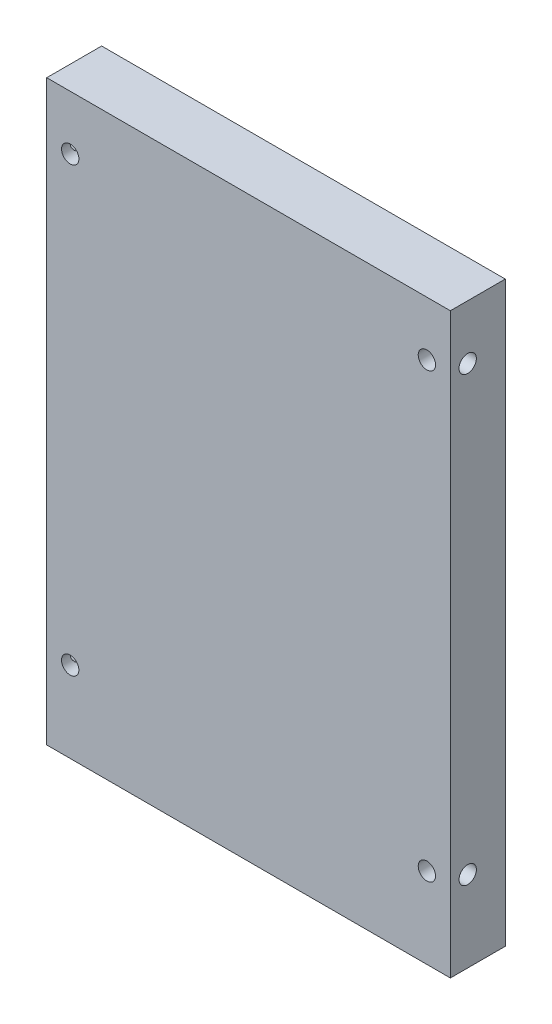
from build123d import *

# Parameters (mm, degrees)
SKETCH_1_W          = 69.85
SKETCH_1_H          = 100
EXTRUDE_1_DEPTH     = 9.5
SKETCH_2_R          = 1.5
CUT_EXTRUDE_1_DEPTH = 3
SKETCH_4_R          = 1.5
CUT_EXTRUDE_3_DEPTH = 3


with BuildPart() as part:
    # 스케치1 → 보스-돌출1 (new body)
    with BuildSketch(Plane.XY):
        with Locations((34.925, 50)):
            Rectangle(SKETCH_1_W, SKETCH_1_H)
    extrude(amount=EXTRUDE_1_DEPTH)

    # 스케치2 → 컷-돌출1 (cut)
    with BuildSketch(Plane(origin=(69.85, 0, 0), x_dir=(0, 0, -1), z_dir=(1, 0, 0))):
        with Locations((-6.5, 90.6)):
            Circle(SKETCH_2_R)
        with Locations(Location((-6.5, 14, 0), (0, 0, 180))):
            Circle(SKETCH_2_R)
    cut_extrude_1 = extrude(amount=-CUT_EXTRUDE_1_DEPTH, mode=Mode.SUBTRACT)

    # 대칭 복사1: 컷-돌출1 across plane
    add(cut_extrude_1.mirror(Plane(origin=(34.925, 0, 0), x_dir=(0, 0, 1), z_dir=(1, 0, 0))), mode=Mode.SUBTRACT)

    # 스케치4 → 컷-돌출3 (cut)
    with BuildSketch(Plane.XY.offset(9.5)):
        with Locations((4.065, 90.6)):
            Circle(SKETCH_4_R)
        with Locations(Location((65.785, 90.6, 0), (0, 0, 315.234915329))):
            Circle(SKETCH_4_R)
        with Locations((4.065, 14)):
            Circle(SKETCH_4_R)
        with Locations(Location((65.785, 14, 0), (0, 0, 44.765084671))):
            Circle(SKETCH_4_R)
    extrude(amount=-CUT_EXTRUDE_3_DEPTH, mode=Mode.SUBTRACT)


solid = part.part
